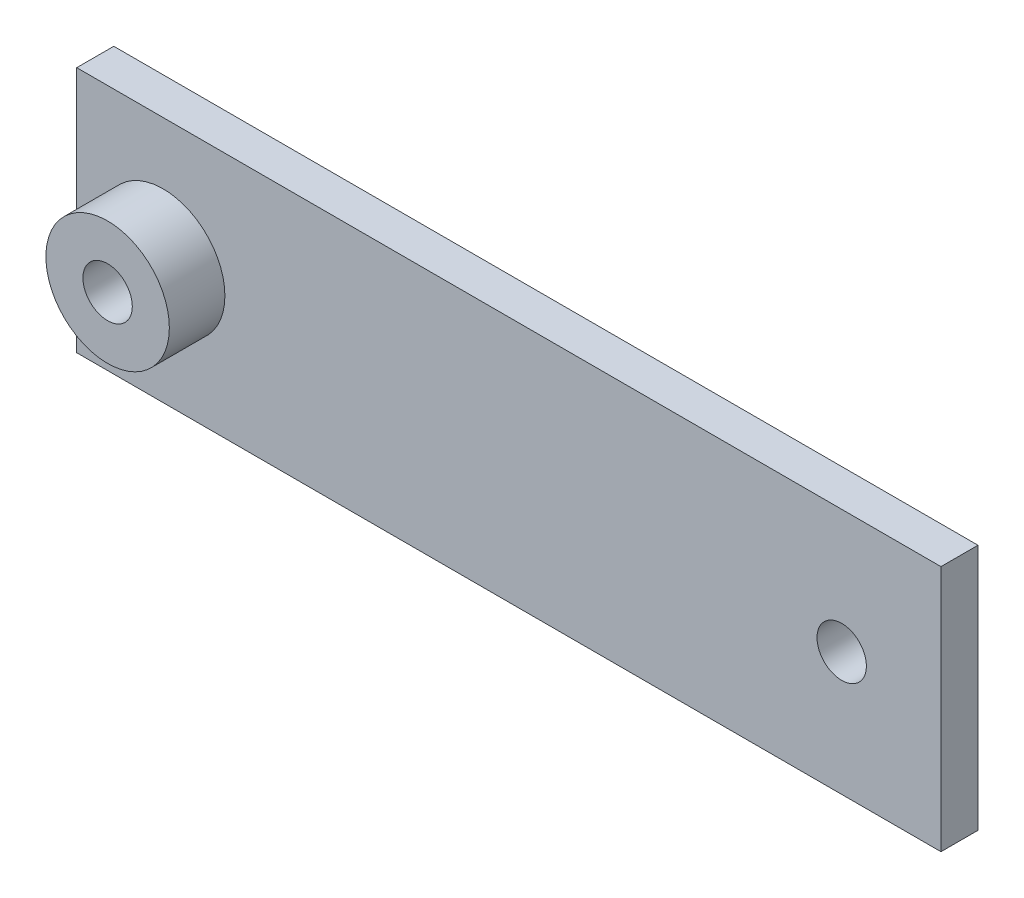
from build123d import *

# Parameters (mm, degrees)
SKETCH1_W           = 70
SKETCH1_H           = 20
BOSS_EXTRUDE1_DEPTH = 3
SKETCH2_R           = 2
CUT_EXTRUDE2_DEPTH  = 37.523964735
SKETCH3_R           = 5
BOSS_EXTRUDE2_DEPTH = 4.5
SKETCH4_R           = 2
CUT_EXTRUDE3_DEPTH  = 4.5


with BuildPart() as part:
    # Sketch1 → Boss-Extrude1 (new body)
    with BuildSketch(Plane.XY):
        Rectangle(SKETCH1_W, SKETCH1_H)
    extrude(amount=BOSS_EXTRUDE1_DEPTH)

    # Sketch2 → Cut-Extrude2 (cut, through all)
    with BuildSketch(Plane.XY.offset(3)):
        with Locations((-28, 0)):
            Circle(SKETCH2_R)
        with Locations((26.96, 0)):
            Circle(SKETCH2_R)
    extrude(amount=-CUT_EXTRUDE2_DEPTH, mode=Mode.SUBTRACT)

    # Sketch3 → Boss-Extrude2 (add)
    with BuildSketch(Plane.XY.offset(3)):
        with Locations((-28, 0)):
            Circle(SKETCH3_R)
    extrude(amount=BOSS_EXTRUDE2_DEPTH)

    # Sketch4 → Cut-Extrude3 (cut)
    with BuildSketch(Plane.XY.offset(7.5)):
        with Locations((-28, 0)):
            Circle(SKETCH4_R)
    extrude(amount=-CUT_EXTRUDE3_DEPTH, mode=Mode.SUBTRACT)


solid = part.part
